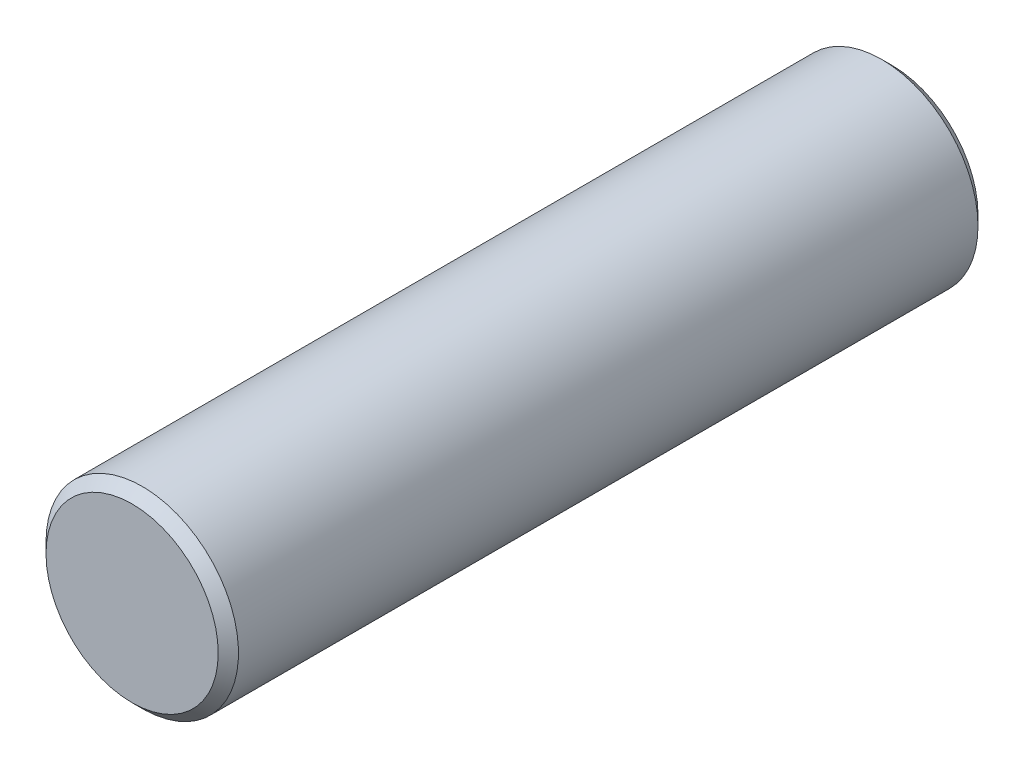
from build123d import *

# Parameters (mm, degrees)
SKETCH1_R           = 4.826
BOSS_EXTRUDE1_DEPTH = 38.1
CHAMFER1_SIZE       = 0.508


with BuildPart() as part:
    # Sketch1 → Boss-Extrude1 (new body)
    with BuildSketch(Plane.XY):
        with Locations(Location((0, 0, 0), (0, 0, 180))):
            Circle(SKETCH1_R)
    extrude(amount=BOSS_EXTRUDE1_DEPTH)

    # Chamfer1
    chamfer1_edges = [part.edges().sort_by_distance(p)[0] for p in [
        (4.826, 0, 0),
        (4.826, 0, 38.1),
    ]]
    chamfer(chamfer1_edges, length=CHAMFER1_SIZE)


solid = part.part
